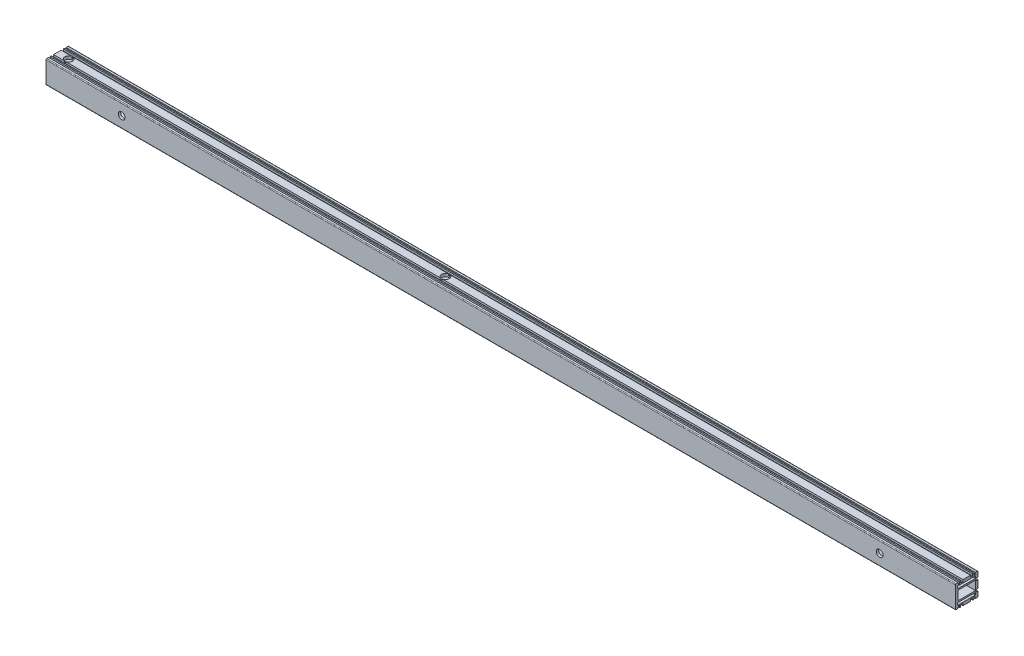
from build123d import *

# Parameters (mm, degrees)
SKETCH_1_W             = 23.5
SKETCH_1_H             = 12
EXTRUDE_1_DEPTH        = 601
HOLE_WIZARD_M6_1_D     = 5
HOLE_WIZARD_M6_1_DEPTH = 15
HOLE_WIZARD_M6_1_TIP   = 1.502151548
HOLE_WIZARD_M6_2_D     = 5
HOLE_WIZARD_M6_2_DEPTH = 15
HOLE_WIZARD_M6_2_TIP   = 1.502151548
SKETCH_6_R             = 5.05
CUT_EXTRUDE_1_DEPTH    = 602.935212461
HOLE_WIZARD_M4_1_D     = 3.3
HOLE_WIZARD_M4_1_DEPTH = 10.1
HOLE_WIZARD_M4_1_TIP   = 0.991420021
SKETCH_9_R             = 4.5
CUT_EXTRUDE_2_DEPTH    = 602.935212461
HOLE_WIZARD_M4_2_D     = 3.3
HOLE_WIZARD_M4_2_DEPTH = 10.1
HOLE_WIZARD_M4_2_TIP   = 0.991420021


with BuildPart() as part:
    # 草图1 → 凸台-拉伸1 (new, symmetric)
    with BuildSketch(Plane(origin=(0, 0, 0), x_dir=(0, 0, -1), z_dir=(1, 0, 0))):
        with BuildLine():
            Line((-14, 15), (-11.5, 15))
            Line((-11.5, 15), (-11.5, 13.5))
            Line((-11.5, 13.5), (-11.4, 13.5))
            ThreePointArc((-11.4, 13.5), (-11.117157288, 13.382842712), (-11, 13.1))
            Line((-11, 13.1), (-11, 12))
            Line((-11, 12), (-9.5, 12))
            Line((-9.5, 12), (-9.5, 15))
            Line((-9.5, 15), (-8, 15))
            Line((-8, 15), (-8, 12.5))
            Line((-8, 12.5), (-5, 12.5))
            Line((-5, 12.5), (-5, 15))
            Line((-5, 15), (5, 15))
            Line((5, 15), (5, 12.5))
            Line((5, 12.5), (8, 12.5))
            Line((8, 12.5), (8, 15))
            Line((8, 15), (9.5, 15))
            Line((9.5, 15), (9.5, 12))
            Line((9.5, 12), (11, 12))
            Line((11, 12), (11, 13.1))
            ThreePointArc((11, 13.1), (11.117157288, 13.382842712), (11.4, 13.5))
            Line((11.4, 13.5), (11.5, 13.5))
            Line((11.5, 13.5), (11.5, 15))
            Line((11.5, 15), (14, 15))
            ThreePointArc((14, 15), (14.707106781, 14.707106781), (15, 14))
            Line((15, 14), (15, 8))
            Line((15, 8), (12.5, 8))
            Line((12.5, 8), (12.5, 5))
            Line((12.5, 5), (15, 5))
            Line((15, 5), (15, -5))
            Line((15, -5), (12.5, -5))
            Line((12.5, -5), (12.5, -8))
            Line((12.5, -8), (15, -8))
            Line((15, -8), (15, -14))
            ThreePointArc((15, -14), (14.707106781, -14.707106781), (14, -15))
            Line((14, -15), (11.5, -15))
            Line((11.5, -15), (11.5, -13.5))
            Line((11.5, -13.5), (11.4, -13.5))
            ThreePointArc((11.4, -13.5), (11.117157288, -13.382842712), (11, -13.1))
            Line((11, -13.1), (11, -12))
            Line((11, -12), (9.5, -12))
            Line((9.5, -12), (9.5, -15))
            Line((9.5, -15), (8, -15))
            Line((8, -15), (8, -12.5))
            Line((8, -12.5), (5, -12.5))
            Line((5, -12.5), (5, -15))
            Line((5, -15), (-5, -15))
            Line((-5, -15), (-5, -12.5))
            Line((-5, -12.5), (-8, -12.5))
            Line((-8, -12.5), (-8, -15))
            Line((-8, -15), (-9.5, -15))
            Line((-9.5, -15), (-9.5, -12))
            Line((-9.5, -12), (-11, -12))
            Line((-11, -12), (-11, -13.1))
            ThreePointArc((-11, -13.1), (-11.117157288, -13.382842712), (-11.4, -13.5))
            Line((-11.4, -13.5), (-11.5, -13.5))
            Line((-11.5, -13.5), (-11.5, -15))
            Line((-11.5, -15), (-14, -15))
            ThreePointArc((-14, -15), (-14.707106781, -14.707106781), (-15, -14))
            Line((-15, -14), (-15, 14))
            ThreePointArc((-15, 14), (-14.707106781, 14.707106781), (-14, 15))
        make_face()
        with BuildLine():
            Line((12, -10.5), (12, -8.5))
            ThreePointArc((12, -8.5), (11.853553391, -8.146446609), (11.5, -8))
            Line((11.5, -8), (-11.5, -8))
            ThreePointArc((-11.5, -8), (-11.853553391, -8.146446609), (-12, -8.5))
            Line((-12, -8.5), (-12, -10.5))
            ThreePointArc((-12, -10.5), (-11.853553391, -10.853553391), (-11.5, -11))
            Line((-11.5, -11), (11.5, -11))
            ThreePointArc((11.5, -11), (11.853553391, -10.853553391), (12, -10.5))
        make_face(mode=Mode.SUBTRACT)
        with BuildLine():
            Line((-11.5, 11), (11.5, 11))
            ThreePointArc((11.5, 11), (11.853553391, 10.853553391), (12, 10.5))
            Line((12, 10.5), (12, 8.5))
            ThreePointArc((12, 8.5), (11.853553391, 8.146446609), (11.5, 8))
            Line((11.5, 8), (-11.5, 8))
            ThreePointArc((-11.5, 8), (-11.853553391, 8.146446609), (-12, 8.5))
            Line((-12, 8.5), (-12, 10.5))
            ThreePointArc((-12, 10.5), (-11.853553391, 10.853553391), (-11.5, 11))
        make_face(mode=Mode.SUBTRACT)
        Rectangle(SKETCH_1_W, SKETCH_1_H, mode=Mode.SUBTRACT)
    extrude(amount=EXTRUDE_1_DEPTH, both=True)

    # M6 螺纹孔1
    with Locations(Plane(origin=(0, 0, -15), x_dir=(-1, 0, 0), z_dir=(0, 0, -1))):
        with Locations((-551, 0), (-536, 0), (536, 0), (551, 0)):
            Hole(HOLE_WIZARD_M6_1_D / 2, depth=HOLE_WIZARD_M6_1_DEPTH)
            with Locations((0, 0, -(HOLE_WIZARD_M6_1_DEPTH + HOLE_WIZARD_M6_1_TIP / 2))):  # 118° drill point
                Cone(0, HOLE_WIZARD_M6_1_D / 2, HOLE_WIZARD_M6_1_TIP, mode=Mode.SUBTRACT)

    # M6 螺纹孔2
    with Locations(Plane.XZ.offset(15)):
        with Locations((551, 0), (536, 0), (299, 0), (284, 0), (214, 0), (199, 0), (-536, 0), (-551, 0)):
            Hole(HOLE_WIZARD_M6_2_D / 2, depth=HOLE_WIZARD_M6_2_DEPTH)
            with Locations((0, 0, -(HOLE_WIZARD_M6_2_DEPTH + HOLE_WIZARD_M6_2_TIP / 2))):  # 118° drill point
                Cone(0, HOLE_WIZARD_M6_2_D / 2, HOLE_WIZARD_M6_2_TIP, mode=Mode.SUBTRACT)

    # 草图6 → 切除-拉伸1 (cut, through all)
    with BuildSketch(Plane.XZ.offset(15)):
        with Locations(Location((-586, 0, 0), (0, 0, 90))):
            Circle(SKETCH_6_R)
        with Locations(Location((-88, 0, 0), (0, 0, 90))):
            Circle(SKETCH_6_R)
    extrude(amount=-CUT_EXTRUDE_1_DEPTH, mode=Mode.SUBTRACT)

    # M4 螺纹孔1
    with Locations(Plane.XZ.offset(15)):
        with Locations((-489, 0), (-329, 0), (-169, 0), (-9, 0), (151, 0)):
            Hole(HOLE_WIZARD_M4_1_D / 2, depth=HOLE_WIZARD_M4_1_DEPTH)
            with Locations((0, 0, -(HOLE_WIZARD_M4_1_DEPTH + HOLE_WIZARD_M4_1_TIP / 2))):  # 118° drill point
                Cone(0, HOLE_WIZARD_M4_1_D / 2, HOLE_WIZARD_M4_1_TIP, mode=Mode.SUBTRACT)

    # 草图9 → 切除-拉伸2 (cut, through all)
    with BuildSketch(Plane.XY.offset(15)):
        with Locations((501, 0)):
            Circle(SKETCH_9_R)
        with Locations((-501, 0)):
            Circle(SKETCH_9_R)
    extrude(amount=-CUT_EXTRUDE_2_DEPTH, mode=Mode.SUBTRACT)

    # M4 螺纹孔2
    with Locations(Plane(origin=(0, 0, -15), x_dir=(-1, 0, 0), z_dir=(0, 0, -1))):
        with Locations((-454, 0), (-259, 0), (-64, 0), (131, 0), (326, 0)):
            Hole(HOLE_WIZARD_M4_2_D / 2, depth=HOLE_WIZARD_M4_2_DEPTH)
            with Locations((0, 0, -(HOLE_WIZARD_M4_2_DEPTH + HOLE_WIZARD_M4_2_TIP / 2))):  # 118° drill point
                Cone(0, HOLE_WIZARD_M4_2_D / 2, HOLE_WIZARD_M4_2_TIP, mode=Mode.SUBTRACT)


solid = part.part
